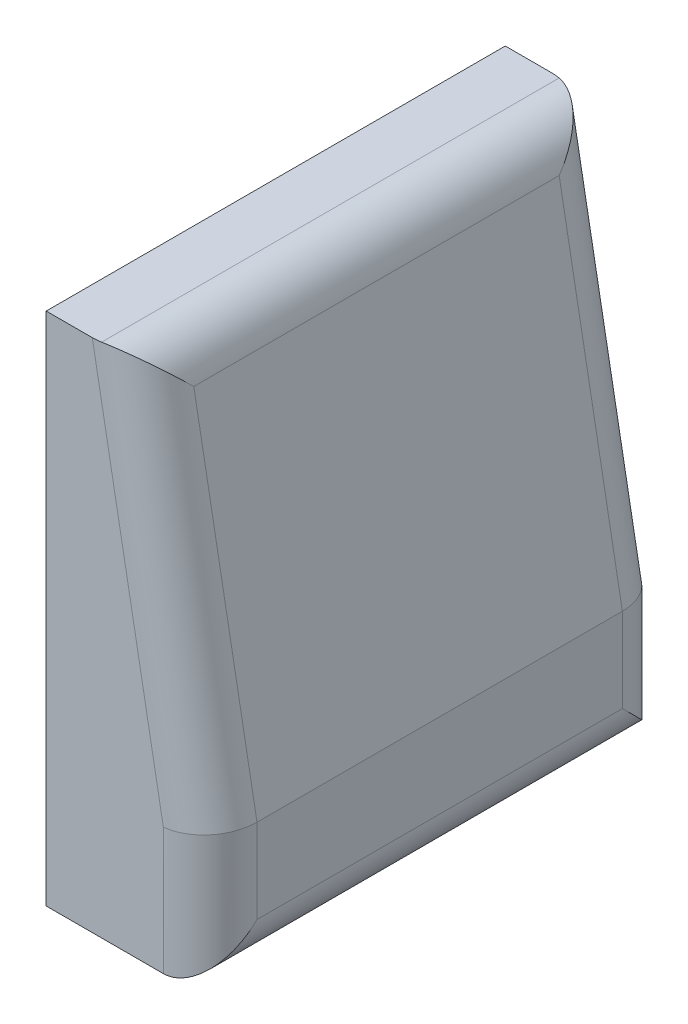
from build123d import *

# Parameters (mm, degrees)
BOSS_EXTRUDE1_DEPTH = 490
FILLET1_R           = 100


with BuildPart() as part:
    # Sketch1 → Boss-Extrude1 (new, symmetric)
    with BuildSketch(Plane.XY):
        Polygon((0, 550), (0, -550), (350, -550), (350, -270), (200, 550), align=None)
    extrude(amount=BOSS_EXTRUDE1_DEPTH, both=True)

    # Fillet1
    fillet1_edges = [part.edges().sort_by_distance(p)[0] for p in [
        (350, -410, 490),
        (275, 140, 490),
        (275, 140, -490),
        (350, -410, -490),
        (200, 550, 0),
        (350, -550, 0),
    ]]
    fillet(fillet1_edges, radius=FILLET1_R)


solid = part.part
